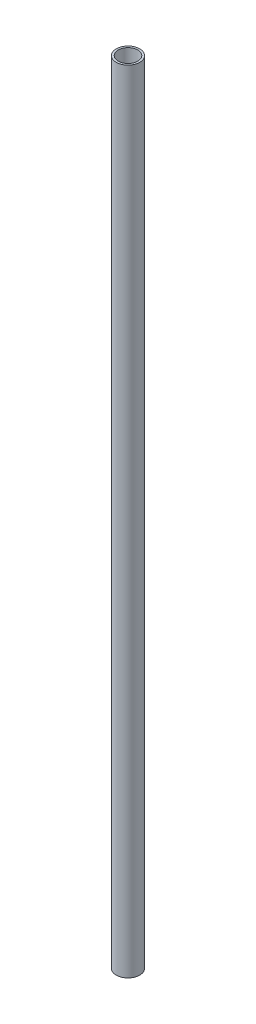
from build123d import *

# Parameters (mm, degrees)
SKETCH1_R           = 12
SKETCH1_R_2         = 10
BOSS_EXTRUDE1_DEPTH = 810


with BuildPart() as part:
    # Sketch1 → Boss-Extrude1 (new body)
    with BuildSketch(Plane(origin=(0, 0, 0), x_dir=(1, 0, 0), z_dir=(0, 1, 0))):
        with Locations(Location((0, 0, 0), (0, 0, 270))):
            Circle(SKETCH1_R)
        with Locations(Location((0, 0, 0), (0, 0, 270))):
            Circle(SKETCH1_R_2, mode=Mode.SUBTRACT)
    extrude(amount=BOSS_EXTRUDE1_DEPTH)


solid = part.part
